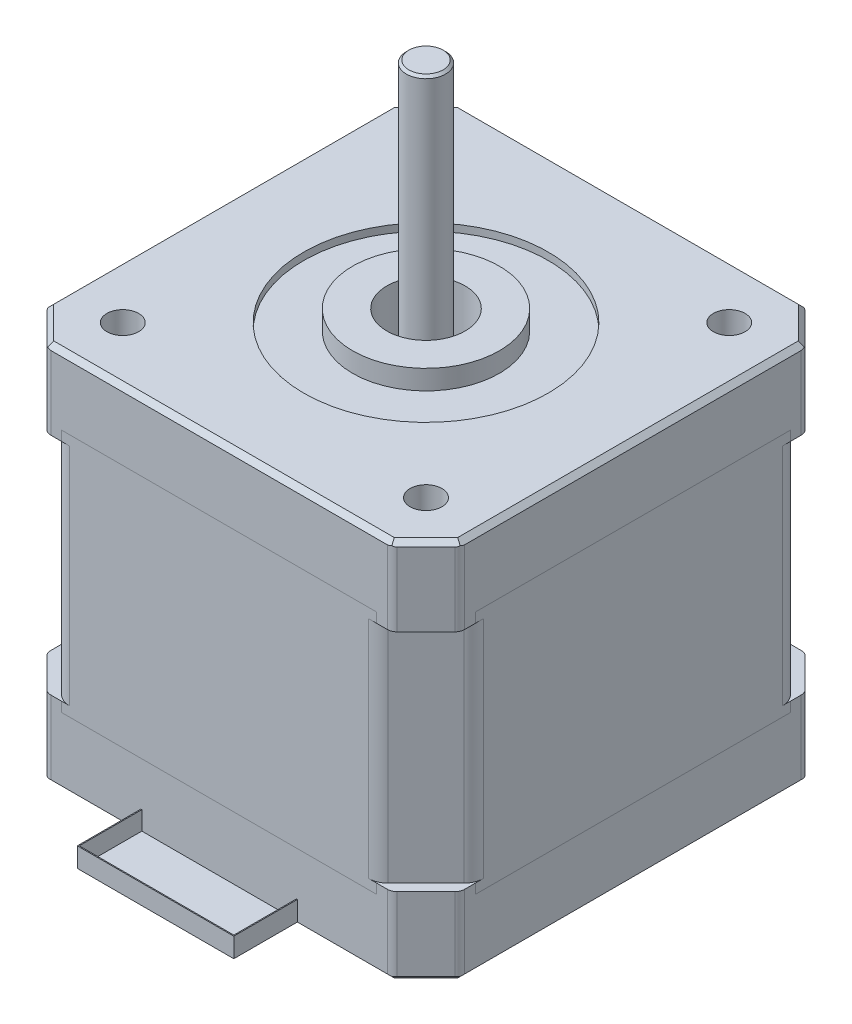
from build123d import *

# Parameters (mm, degrees)
BOSS_EXTRUDE1_DEPTH  = 8
SKETCH2_R            = 1.624765057
CUT_EXTRUDE1_DEPTH   = 6
CHAMFER1_SIZE        = 0.5
SKETCH3_W            = 32.228932188
SKETCH3_H            = 1
CUT_EXTRUDE2_DEPTH   = 48.964700562
SKETCH4_W            = 32.228932188
SKETCH4_H            = 1
CUT_EXTRUDE3_DEPTH   = 48.964700562
CUT_EXTRUDE4_DEPTH   = 1
MIRROR2_COPY_1_DEPTH = 1
BOSS_EXTRUDE2_DEPTH  = 24
BOSS_EXTRUDE4_DEPTH  = 8
SKETCH22_W           = 16
SKETCH22_H           = 2.5
BOSS_EXTRUDE5_DEPTH  = 6.5
CHAMFER3_SIZE        = 0.5
SKETCH23_W           = 15.8
SKETCH23_H           = 6.4
CUT_EXTRUDE5_DEPTH   = 1.9
SKETCH24_R           = 12.5
CUT_EXTRUDE6_DEPTH   = 0.75
SKETCH25_R           = 7.5
BOSS_EXTRUDE6_DEPTH  = 2
SKETCH26_R           = 4
CUT_EXTRUDE7_DEPTH   = 5
SKETCH27_R           = 2
BOSS_EXTRUDE7_DEPTH  = 27
CHAMFER5_SIZE        = 0.25
FILLET1_R            = 2
FILLET3_R            = 1
FILLET4_R            = 1


with BuildPart() as part:
    # Sketch1 → Boss-Extrude1 (new body)
    with BuildSketch(Plane(origin=(0, 0, 0), x_dir=(1, 0, 0), z_dir=(0, 1, 0))):
        Polygon((-21.15, -17.614466094), (-21.15, 17.614466094), (-17.614466094, 21.15), (17.614466094, 21.15), (21.15, 17.614466094), (21.15, -17.614466094), (17.614466094, -21.15), (-17.614466094, -21.15), align=None)
    extrude(amount=-BOSS_EXTRUDE1_DEPTH)

    # Sketch2 → Cut-Extrude1 (cut)
    with BuildSketch(Plane(origin=(0, 0, 0), x_dir=(1, 0, 0), z_dir=(0, 1, 0))):
        with Locations(Location((-15.5, 15.5, 0), (0, 0, 270))):
            Circle(SKETCH2_R)
        with Locations(Location((15.5, 15.5, 0), (0, 0, 90))):
            Circle(SKETCH2_R)
        with Locations(Location((15.5, -15.5, 0), (0, 0, 270))):
            Circle(SKETCH2_R)
        with Locations(Location((-15.5, -15.5, 0), (0, 0, 90))):
            Circle(SKETCH2_R)
    extrude(amount=-CUT_EXTRUDE1_DEPTH, mode=Mode.SUBTRACT)

    # Chamfer1
    chamfer1_edges = [part.edges().sort_by_distance(p)[0] for p in [
        (21.15, 0, 0),
        (19.382233047, 0, 19.382233047),
        (0, 0, 21.15),
        (-19.382233047, 0, 19.382233047),
        (-21.15, 0, 0),
        (-19.382233047, 0, -19.382233047),
        (0, 0, -21.15),
        (19.382233047, 0, -19.382233047),
    ]]
    chamfer(chamfer1_edges, length=CHAMFER1_SIZE)

    # Sketch3 → Cut-Extrude2 (cut, through all)
    with BuildSketch(Plane(origin=(21.15, 0, 0), x_dir=(0, 0, -1), z_dir=(1, 0, 0))):
        with Locations((0, -7.5)):
            Rectangle(SKETCH3_W, SKETCH3_H)
    extrude(amount=-CUT_EXTRUDE2_DEPTH, mode=Mode.SUBTRACT)

    # Sketch4 → Cut-Extrude3 (cut, through all)
    with BuildSketch(Plane.XY.offset(21.15)):
        with Locations((0, -7.5)):
            Rectangle(SKETCH4_W, SKETCH4_H)
    extrude(amount=-CUT_EXTRUDE3_DEPTH, mode=Mode.SUBTRACT)

    # Sketch5 → Cut-Extrude4 (cut)
    with BuildSketch(Plane.XZ.offset(8)):
        Polygon((-21.15, 16.114466094), (-16.114466094, 21.15), (-16.114466094, 16.114466094), align=None)
    cut_extrude4 = extrude(amount=-CUT_EXTRUDE4_DEPTH, mode=Mode.SUBTRACT)

    # Mirror1: Cut-Extrude4 across plane
    add(cut_extrude4.mirror(Plane(origin=(0, 0, 0), x_dir=(0, 0, 1), z_dir=(1, 0, 0))), mode=Mode.SUBTRACT)

    # Mirror2: Cut-Extrude4 across plane
    add(cut_extrude4.mirror(Plane.XY), mode=Mode.SUBTRACT)

    # Mirror2 copy 1 sketch → Mirror2 copy 1 (cut)
    with BuildSketch(Plane(origin=(0, -8, 0), x_dir=(-1, 0, 0), z_dir=(0, -1, 0))):
        Polygon((-21.15, 16.114466094), (-16.114466094, 21.15), (-16.114466094, 16.114466094), align=None)
    extrude(amount=-MIRROR2_COPY_1_DEPTH, mode=Mode.SUBTRACT)

    # Sketch6 → Boss-Extrude2 (add)
    with BuildSketch(Plane.XZ.offset(7)):
        Polygon((-21.15, -16.114466094), (-21.15, 16.114466094), (-16.114466094, 21.15), (16.114466094, 21.15), (21.15, 16.114466094), (21.15, -16.114466094), (16.114466094, -21.15), (-16.114466094, -21.15), align=None)
    extrude(amount=BOSS_EXTRUDE2_DEPTH)

    # Sketch16 → Boss-Extrude4 (add)
    with BuildSketch(Plane.XZ.offset(31)):
        Polygon((-21.15, -17.614466094), (-21.15, 17.614466094), (-17.614466094, 21.15), (17.614466094, 21.15), (21.15, 17.614466094), (21.15, -17.614466094), (17.614466094, -21.15), (-17.614466094, -21.15), align=None)
    extrude(amount=BOSS_EXTRUDE4_DEPTH)

    # Sketch22 → Boss-Extrude5 (add)
    with BuildSketch(Plane.XY.offset(21.15)):
        with Locations((0, -37.75)):
            Rectangle(SKETCH22_W, SKETCH22_H)
    extrude(amount=BOSS_EXTRUDE5_DEPTH)

    # Chamfer3
    chamfer3_edges = [part.edges().sort_by_distance(p)[0] for p in [
        (-19.382233047, -39, -19.382233047),
        (0, -39, -21.15),
        (19.382233047, -39, -19.382233047),
        (21.15, -39, 0),
        (19.382233047, -39, 19.382233047),
        (12.807233047, -39, 21.15),
        (-19.382233047, -39, 19.382233047),
        (-21.15, -39, 0),
        (-12.807233047, -39, 21.15),
        (-8, -39, 24.4),
        (8, -39, 24.4),
        (0, -39, 27.65),
    ]]
    chamfer(chamfer3_edges, length=CHAMFER3_SIZE)

    # Sketch23 → Cut-Extrude5 (cut)
    with BuildSketch(Plane(origin=(0, -36.5, 0), x_dir=(1, 0, 0), z_dir=(0, 1, 0))):
        with Locations((0, -24.35)):
            Rectangle(SKETCH23_W, SKETCH23_H)
    extrude(amount=-CUT_EXTRUDE5_DEPTH, mode=Mode.SUBTRACT)

    # Sketch24 → Cut-Extrude6 (cut)
    with BuildSketch(Plane(origin=(0, 0, 0), x_dir=(1, 0, 0), z_dir=(0, 1, 0))):
        with Locations(Location((0, 0, 0), (0, 0, 270))):
            Circle(SKETCH24_R)
    extrude(amount=-CUT_EXTRUDE6_DEPTH, mode=Mode.SUBTRACT)

    # Sketch25 → Boss-Extrude6 (add)
    with BuildSketch(Plane(origin=(0, -0.75, 0), x_dir=(1, 0, 0), z_dir=(0, 1, 0))):
        with Locations(Location((0, 0, 0), (0, 0, 270))):
            Circle(SKETCH25_R)
    extrude(amount=BOSS_EXTRUDE6_DEPTH)

    # Sketch26 → Cut-Extrude7 (cut)
    with BuildSketch(Plane(origin=(0, 1.25, 0), x_dir=(1, 0, 0), z_dir=(0, 1, 0))):
        with Locations(Location((0, 0, 0), (0, 0, 270))):
            Circle(SKETCH26_R)
    extrude(amount=-CUT_EXTRUDE7_DEPTH, mode=Mode.SUBTRACT)

    # Sketch27 → Boss-Extrude7 (add)
    with BuildSketch(Plane(origin=(0, -3.75, 0), x_dir=(1, 0, 0), z_dir=(0, 1, 0))):
        with Locations(Location((0, 0, 0), (0, 0, 270))):
            Circle(SKETCH27_R)
    extrude(amount=BOSS_EXTRUDE7_DEPTH)

    # Chamfer5
    chamfer5_edges = [part.edges().sort_by_distance(p)[0] for p in [
        (0, 23.25, -2),
    ]]
    chamfer(chamfer5_edges, length=CHAMFER5_SIZE)

    # Fillet1
    fillet1_edges = [part.edges().sort_by_distance(p)[0] for p in [
        (-21.15, -19.5, -16.114466094),
        (-16.114466094, -19.5, -21.15),
        (16.114466094, -19.5, -21.15),
        (21.15, -19.5, -16.114466094),
        (21.15, -19.5, 16.114466094),
        (16.114466094, -19.5, 21.15),
        (-16.114466094, -19.5, 21.15),
        (-21.15, -19.5, 16.114466094),
    ]]
    fillet(fillet1_edges, radius=FILLET1_R)

    # Fillet3
    fillet3_edges = [part.edges().sort_by_distance(p)[0] for p in [
        (-21.15, -4.25, 17.614466094),
        (-21.15, -4.25, -17.614466094),
        (-17.614466094, -4.25, -21.15),
        (17.614466094, -4.25, -21.15),
        (21.15, -4.25, -17.614466094),
        (21.15, -4.25, 17.614466094),
        (17.614466094, -4.25, 21.15),
        (-17.614466094, -4.25, 21.15),
    ]]
    fillet(fillet3_edges, radius=FILLET3_R)

    # Fillet4
    fillet4_edges = [part.edges().sort_by_distance(p)[0] for p in [
        (-21.15, -34.75, -17.614466094),
        (-21.15, -34.75, 17.614466094),
        (-17.614466094, -34.75, 21.15),
        (17.614466094, -34.75, 21.15),
        (21.15, -34.75, 17.614466094),
        (21.15, -34.75, -17.614466094),
        (17.614466094, -34.75, -21.15),
        (-17.614466094, -34.75, -21.15),
    ]]
    fillet(fillet4_edges, radius=FILLET4_R)


solid = part.part
